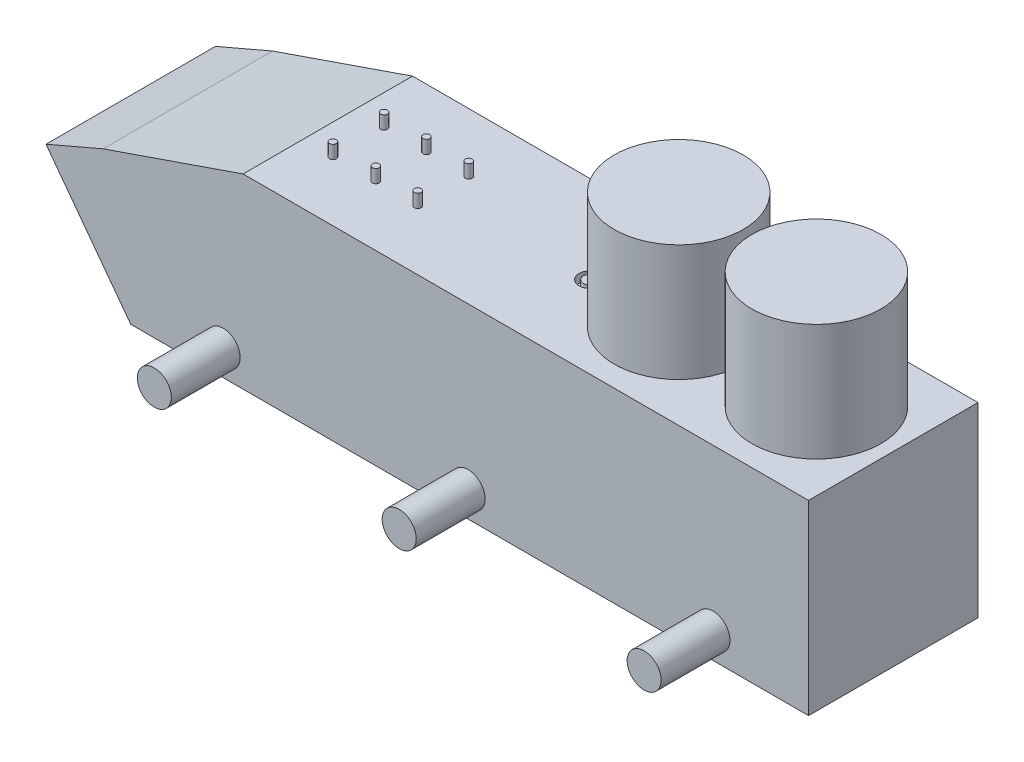
from build123d import *

# Parameters (mm, degrees)
BOSS_EXTRUDE1_DEPTH     = 500
CUT_EXTRUDE2_DEPTH      = 1749.450897396
CUT_EXTRUDE2_DEPTH_BACK = 1749.450897396
SKETCH11_R              = 10
BOSS_EXTRUDE8_DEPTH     = 330
SKETCH12_R              = 50.165
BOSS_EXTRUDE14_DEPTH    = 203.2
BOSS_EXTRUDE15_START    = 203.2
SKETCH15_R              = 50.165
BOSS_EXTRUDE15_DEPTH    = 203.2
SKETCH17_R              = 50.292
BOSS_EXTRUDE16_DEPTH    = 203.2
SKETCH18_R              = 50.165
BOSS_EXTRUDE17_DEPTH    = 203.2
SKETCH9_R               = 190.5
BOSS_EXTRUDE19_DEPTH    = 635
SKETCH19_R              = 31.75
SKETCH19_R_2            = 19.05
CUT_EXTRUDE5_DEPTH      = 25.4


with BuildPart() as part:
    # Sketch2 → Boss-Extrude1 (new body)
    with BuildSketch(Plane.XY):
        Polygon((-600, 76.079136691), (-100, 290.827338129), (1650, 290.827338129), (1650, -259.172661871), (-350, -259.172661871), align=None)
    extrude(amount=BOSS_EXTRUDE1_DEPTH)

    # Sketch3 → Cut-Extrude2 (cut, two sides: drawn at the far end of the back side and taken through both)
    with BuildSketch(Plane.XY.offset(-CUT_EXTRUDE2_DEPTH_BACK)):
        Polygon((-629.160159728, 80.318281341), (0, 297.197748554), (-133.945595933, 297.197748554), align=None)
    extrude(amount=CUT_EXTRUDE2_DEPTH + CUT_EXTRUDE2_DEPTH_BACK, mode=Mode.SUBTRACT)

    # Sketch11 → Boss-Extrude8 (add)
    with BuildSketch(Plane(origin=(0, 0, 0), x_dir=(1, 0, 0), z_dir=(0, 1, 0))):
        with Locations((320.593573559, -323.788946962)):
            Circle(SKETCH11_R)
        with Locations(Location((70.593573559, -323.788946962, 0), (0, 0, 90))):
            Circle(SKETCH11_R)
        with Locations((195.593573559, -322.326233751)):
            Circle(SKETCH11_R)
        with Locations(Location((320.593573559, -173.125553361, 0), (0, 0, 90))):
            Circle(SKETCH11_R)
        with Locations(Location((195.593573559, -173.125553361, 0), (0, 0, 90))):
            Circle(SKETCH11_R)
        with Locations((70.593573559, -173.125553361)):
            Circle(SKETCH11_R)
    extrude(amount=BOSS_EXTRUDE8_DEPTH)

    # Sketch12 → Boss-Extrude14 (add)
    with BuildSketch(Plane(origin=(0, 0, 0), x_dir=(-1, 0, 0), z_dir=(0, 0, -1))):
        with Locations(Location((-1345.2, -182.972661871, 0), (0, 0, 180))):
            Circle(SKETCH12_R)
        with Locations(Location((77.2, -182.972661871, 0), (0, 0, 180))):
            Circle(SKETCH12_R)
    extrude(amount=BOSS_EXTRUDE14_DEPTH)

    # Sketch15 → Boss-Extrude15 (add)
    with BuildSketch(Plane.XY.offset(500).offset(BOSS_EXTRUDE15_START)):
        with Locations((1368.06, -182.972661871)):
            Circle(SKETCH15_R)
        with Locations((-77.2, -182.972661871)):
            Circle(SKETCH15_R)
    extrude(amount=-BOSS_EXTRUDE15_DEPTH)

    # Sketch17 → Boss-Extrude16 (add, through all)
    with BuildSketch(Plane.XY.offset(500)):
        with Locations((645.43, -182.972661871)):
            Circle(SKETCH17_R)
    extrude(amount=BOSS_EXTRUDE16_DEPTH)

    # Sketch18 → Boss-Extrude17 (add, through all)
    with BuildSketch(Plane(origin=(0, 0, 0), x_dir=(-1, 0, 0), z_dir=(0, 0, -1))):
        with Locations(Location((-622.57, -182.972661871, 0), (0, 0, 180))):
            Circle(SKETCH18_R)
    extrude(amount=BOSS_EXTRUDE17_DEPTH)

    # Sketch9 → Boss-Extrude19 (add)
    with BuildSketch(Plane(origin=(0, 0, 0), x_dir=(1, 0, 0), z_dir=(0, 1, 0))):
        with Locations(Location((1421.4, -248.149283127, 0), (0, 0, 90))):
            Circle(SKETCH9_R)
        with Locations(Location((1015, -248.149283127, 0), (0, 0, 90))):
            Circle(SKETCH9_R)
    extrude(amount=BOSS_EXTRUDE19_DEPTH)

    # Sketch19 → Cut-Extrude5 (cut)
    with BuildSketch(Plane(origin=(0, 290.827338129, 0), x_dir=(1, 0, 0), z_dir=(0, 1, 0))):
        with Locations(Location((763.220602861, -258.539612091, 0), (0, 0, 180))):
            Circle(SKETCH19_R)
        with Locations(Location((763.220602861, -258.539612091, 0), (0, 0, 180))):
            Circle(SKETCH19_R_2, mode=Mode.SUBTRACT)
    extrude(amount=-CUT_EXTRUDE5_DEPTH, mode=Mode.SUBTRACT)


solid = part.part
